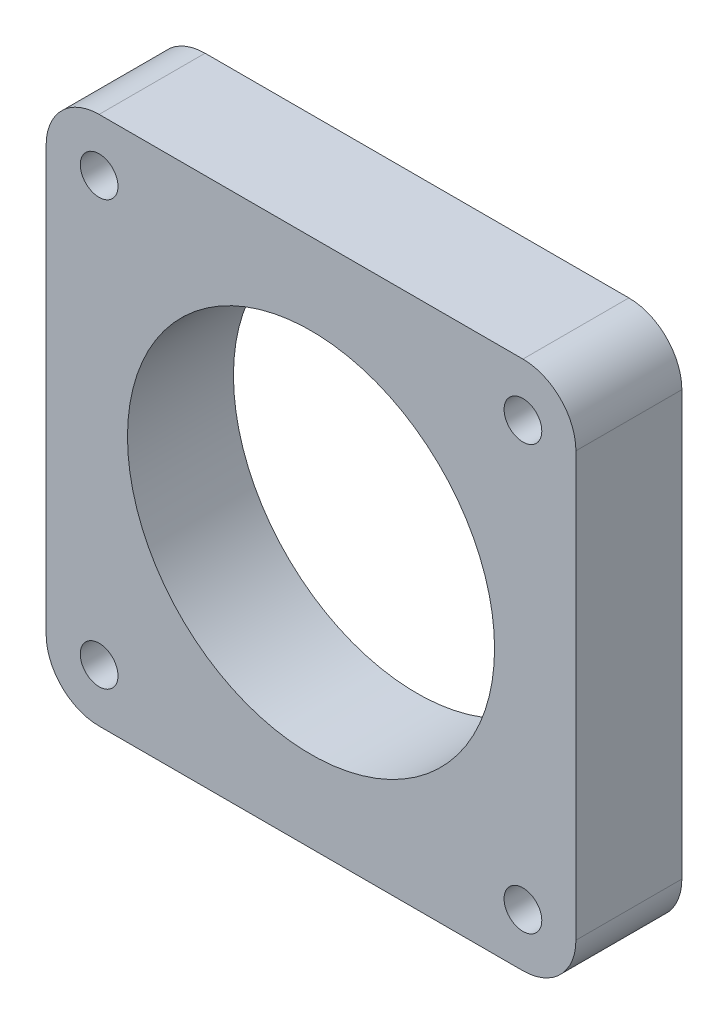
from build123d import *

# Parameters (mm, degrees)
SKETCH1_W           = 31.75
SKETCH1_H           = 31.75
SKETCH1_R           = 11
SKETCH1_R_2         = 1.1303
BOSS_EXTRUDE1_DEPTH = 6.35
FILLET1_R           = 3.175


with BuildPart() as part:
    # Sketch1 → Boss-Extrude1 (new body)
    with BuildSketch(Plane.XY):
        Rectangle(SKETCH1_W, SKETCH1_H)
        Circle(SKETCH1_R, mode=Mode.SUBTRACT)
        with Locations((-12.7, 12.7)):
            Circle(SKETCH1_R_2, mode=Mode.SUBTRACT)
        with Locations((-12.7, -12.7)):
            Circle(SKETCH1_R_2, mode=Mode.SUBTRACT)
        with Locations((12.7, -12.7)):
            Circle(SKETCH1_R_2, mode=Mode.SUBTRACT)
        with Locations((12.7, 12.7)):
            Circle(SKETCH1_R_2, mode=Mode.SUBTRACT)
    extrude(amount=BOSS_EXTRUDE1_DEPTH)

    # Fillet1
    fillet1_edges = [part.edges().sort_by_distance(p)[0] for p in [
        (-15.875, 15.875, 3.175),
        (15.875, 15.875, 3.175),
        (15.875, -15.875, 3.175),
        (-15.875, -15.875, 3.175),
    ]]
    fillet(fillet1_edges, radius=FILLET1_R)


solid = part.part
